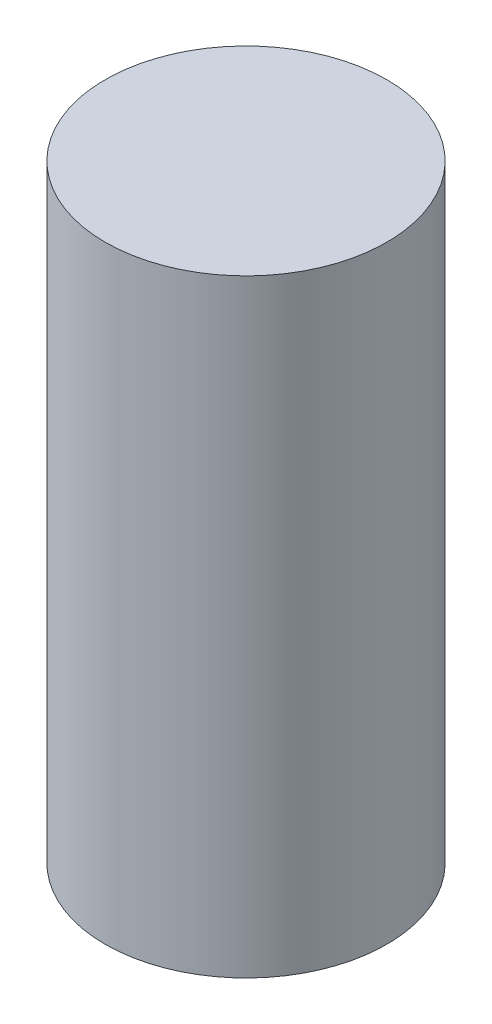
from build123d import *

# Parameters (mm, degrees)
SKETCH1_R              = 44
KOLA1L_GOVDE_D88_DEPTH = 190


with BuildPart() as part:
    # Sketch1 → KOLA1L_govde_D88 (new body)
    with BuildSketch(Plane(origin=(0, 0, 0), x_dir=(1, 0, 0), z_dir=(0, 1, 0))):
        with Locations(Location((0, 0, 0), (0, 0, 270))):
            Circle(SKETCH1_R)
    extrude(amount=KOLA1L_GOVDE_D88_DEPTH)


solid = part.part
